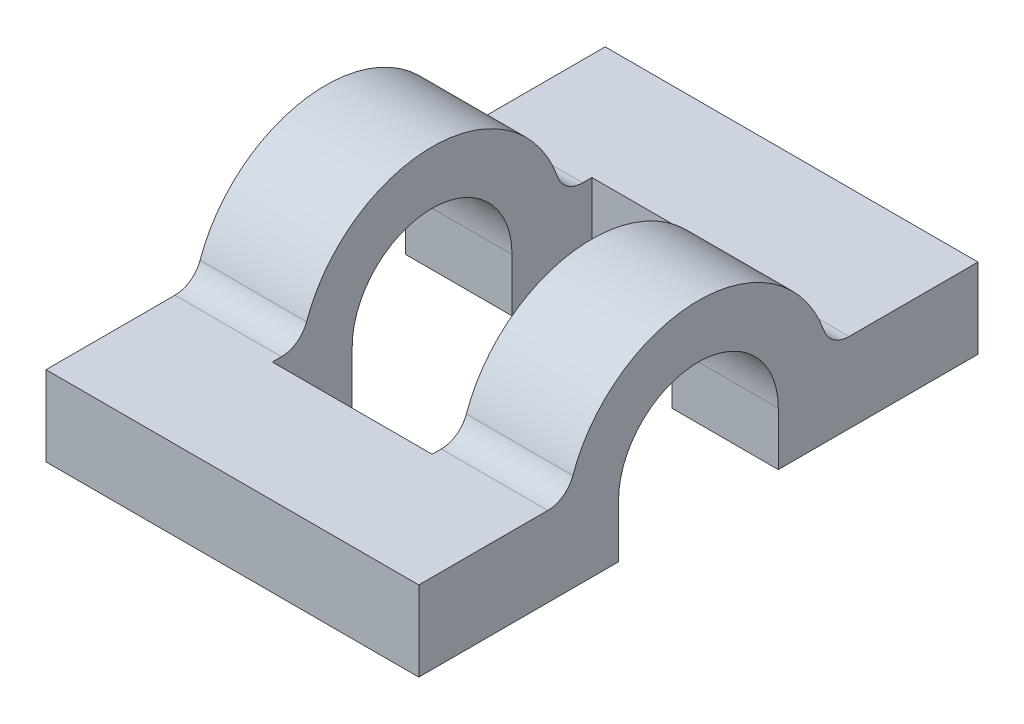
from build123d import *

# Parameters (mm, degrees)
EXTRUDE_1_DEPTH     = 14
SKETCH_3_W          = 6
SKETCH_3_H          = 12
CUT_EXTRUDE_1_DEPTH = 19.848076825
FILLET_2_R          = 1


with BuildPart() as part:
    # 草图2 → 凸台-拉伸1 (new body)
    with BuildSketch(Plane(origin=(0, 0, 0), x_dir=(0, 0, -1), z_dir=(1, 0, 0))):
        with BuildLine():
            Line((10.5, 0), (3, 0))
            Line((3, 0), (3, 2))
            ThreePointArc((3, 2), (0, 5), (-3, 2))
            Line((-3, 2), (-3, 0))
            Line((-3, 0), (-10.5, 0))
            Line((-10.5, 0), (-10.5, 3))
            Line((-10.5, 3), (-4.898979486, 3))
            ThreePointArc((-4.898979486, 3), (0, 7), (4.898979486, 3))
            Line((4.898979486, 3), (10.5, 3))
            Line((10.5, 3), (10.5, 0))
        make_face()
    extrude(amount=EXTRUDE_1_DEPTH)

    # 草图3 → 切除-拉伸1 (cut, through all)
    with BuildSketch(Plane.XZ):
        with Locations((7, 0)):
            Rectangle(SKETCH_3_W, SKETCH_3_H)
    extrude(amount=-CUT_EXTRUDE_1_DEPTH, mode=Mode.SUBTRACT)

    # 圆角2
    fillet_2_edges = [part.edges().sort_by_distance(p)[0] for p in [
        (12, 3, 4.898979486),
        (12, 3, -4.898979486),
        (2, 3, 4.898979486),
        (2, 3, -4.898979486),
    ]]
    fillet(fillet_2_edges, radius=FILLET_2_R)


solid = part.part
